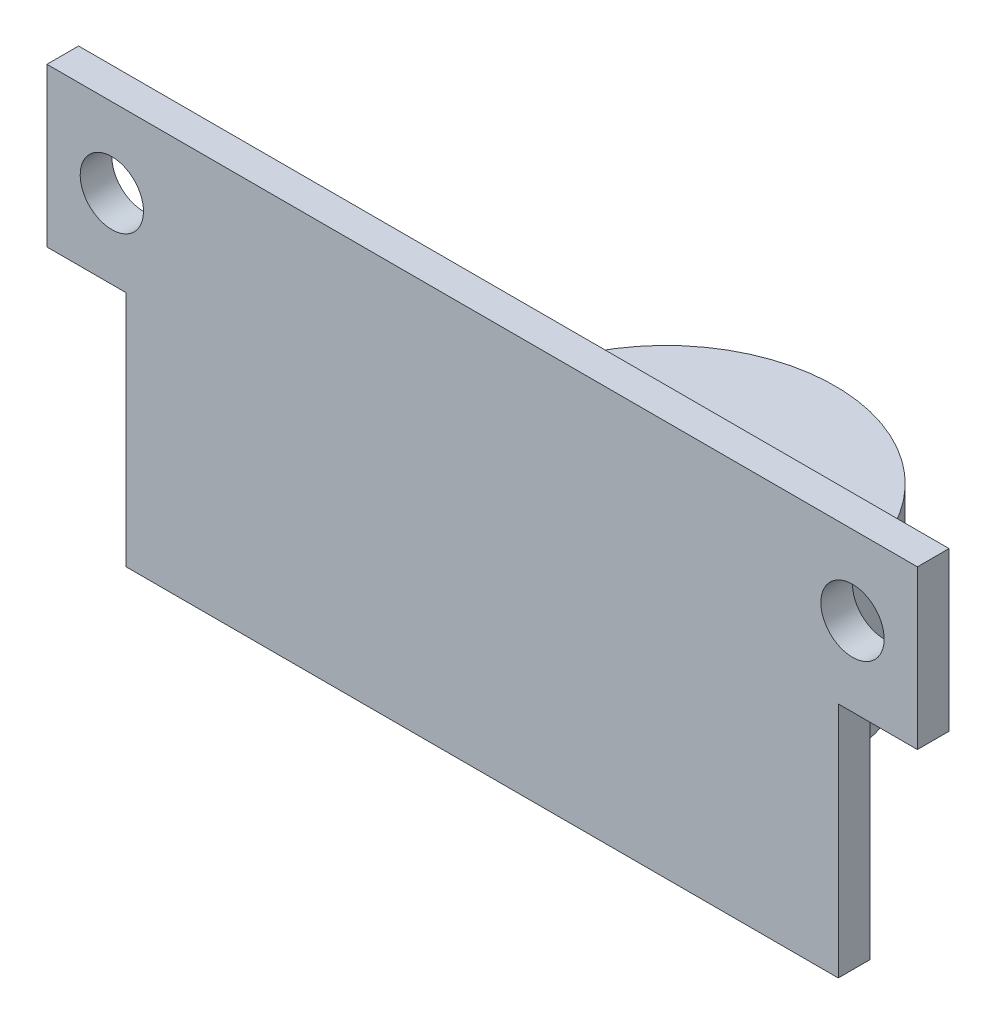
from build123d import *

# Parameters (mm, degrees)
BOSS_EXTRUDE1_START = 4
SKETCH1_W           = 45
SKETCH1_H           = 15
SKETCH1_W_2         = 55
SKETCH1_H_2         = 10
SKETCH1_R           = 2
BOSS_EXTRUDE1_DEPTH = 2
SKETCH2_R           = 10.7
SKETCH2_R_2         = 4.1
BOSS_EXTRUDE2_DEPTH = 10
BOSS_EXTRUDE3_START = -10
BOSS_EXTRUDE3_DEPTH = 10


with BuildPart() as part:
    # Sketch1 → Boss-Extrude1 (new body)
    # profile 1 of 2: a face of its own
    with BuildSketch(Plane.XY.offset(BOSS_EXTRUDE1_START)):
        with Locations((15.006572053, -17.5)):
            Rectangle(SKETCH1_W, SKETCH1_H)
    # profile 2 of 2: a face of its own
    with BuildSketch(Plane.XY.offset(BOSS_EXTRUDE1_START)):
        with Locations((15.006572053, -5)):
            Rectangle(SKETCH1_W_2, SKETCH1_H_2)
        with Locations(Location((-8.393427947, -5, 0), (0, 0, 90))):
            Circle(SKETCH1_R, mode=Mode.SUBTRACT)
        with Locations(Location((38.406572053, -5, 0), (0, 0, 90))):
            Circle(SKETCH1_R, mode=Mode.SUBTRACT)
    extrude(amount=BOSS_EXTRUDE1_DEPTH)

    # Sketch2 → Boss-Extrude2 (add)
    with BuildSketch(Plane(origin=(0, -25, 0), x_dir=(1, 0, 0), z_dir=(0, 1, 0))):
        with Locations((15.006572053, 5.6)):
            Circle(SKETCH2_R)
        with Locations(Location((15.006572053, 5.6, 0), (0, 0, 270))):
            Circle(SKETCH2_R_2, mode=Mode.SUBTRACT)
    extrude(amount=BOSS_EXTRUDE2_DEPTH)

    # Sketch3 → Boss-Extrude3 (add)
    with BuildSketch(Plane(origin=(0, -15, 0), x_dir=(1, 0, 0), z_dir=(0, 1, 0)).offset(BOSS_EXTRUDE3_START)):
        with BuildLine():
            Line((25.706572053, 5.6), (19.106572053, 5.6))
            ThreePointArc((19.106572053, 5.6), (15.006572053, 1.5), (10.906572053, 5.6))
            Line((10.906572053, 5.6), (4.306572053, 5.6))
            ThreePointArc((4.306572053, 5.6), (5.922177371, -0.053651322), (10.281109113, -4))
            Line((10.281109113, -4), (19.732034993, -4))
            ThreePointArc((19.732034993, -4), (24.090966734, -0.053651322), (25.706572053, 5.6))
        make_face()
        with BuildLine():
            Line((25.706572053, -6), (25.706572053, 5.6))
            ThreePointArc((25.706572053, 5.6), (24.090966734, -0.053651322), (19.732034993, -4))
            Line((19.732034993, -4), (10.281109113, -4))
            ThreePointArc((10.281109113, -4), (5.922177371, -0.053651322), (4.306572053, 5.6))
            Line((4.306572053, 5.6), (4.306572053, -6))
            Line((4.306572053, -6), (25.706572053, -6))
        make_face()
    extrude(amount=BOSS_EXTRUDE3_DEPTH)


solid = part.part
